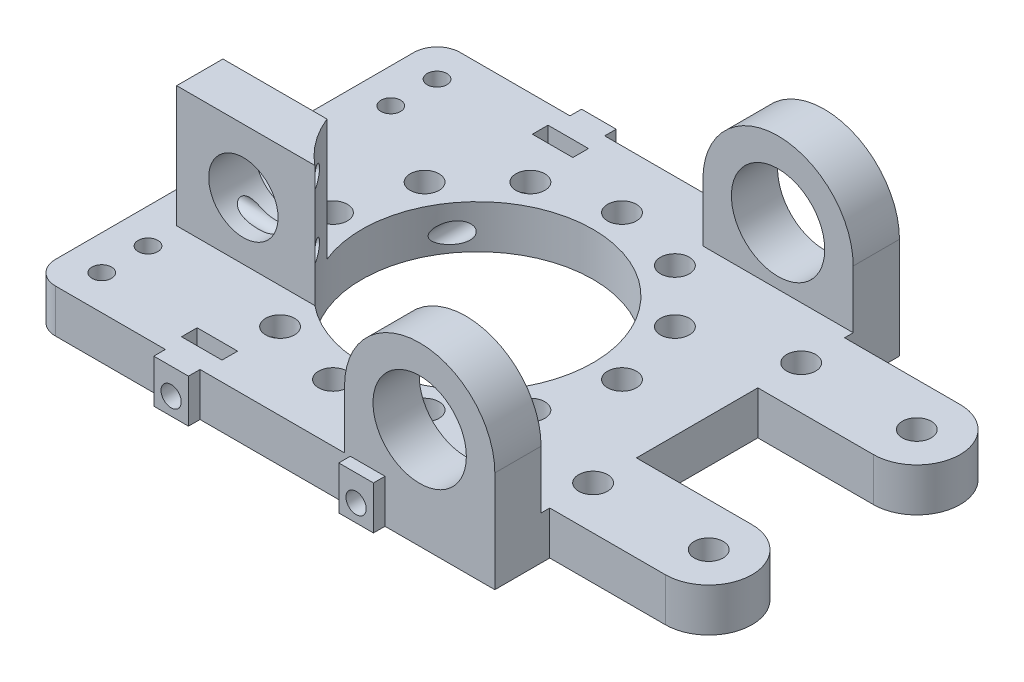
from build123d import *
from build123d.topology import SkipClean

# Parameters (mm, degrees)
BOSS_EXTRUDE1_DEPTH = 7.5
SKETCH2_W           = 6
SKETCH2_H           = 7.5
BOSS_EXTRUDE2_DEPTH = 2
SKETCH3_R           = 8.075
BOSS_EXTRUDE3_DEPTH = 8
SKETCH4_W           = 7
SKETCH4_H           = 2.7
CUT_EXTRUDE1_DEPTH  = 7.5
SKETCH5_R           = 1.7
CUT_EXTRUDE2_DEPTH  = 83.797946834
SKETCH6_R           = 20
CUT_EXTRUDE3_DEPTH  = 83.797946834
SKETCH7_R           = 2.5
CUT_EXTRUDE4_DEPTH  = 83.797946834
SKETCH8_R           = 1.75
CUT_EXTRUDE5_DEPTH  = 105.701957957
BOSS_EXTRUDE4_DEPTH = 28.5
CUT_EXTRUDE6_REACH  = 92.79
SKETCH11_R          = 6
CUT_EXTRUDE7_REACH  = 114.745
SKETCH12_R          = 1.5
SKETCH14_R          = 2.5
CUT_EXTRUDE8_DEPTH  = 83.797946834
FILLET1_R           = 4


with BuildPart() as part:
    # Sketch1 → Boss-Extrude1 (new body)
    with BuildSketch(Plane(origin=(0, 0, 0), x_dir=(1, 0, 0), z_dir=(0, 1, 0))):
        with BuildLine():
            Line((-40, 35), (40, 35))
            Line((40, 35), (40, 25.5))
            Line((40, 25.5), (60, 25.5))
            ThreePointArc((60, 25.5), (67.5, 18), (60, 10.5))
            Line((60, 10.5), (40, 10.5))
            Line((40, 10.5), (40, -10.5))
            Line((40, -10.5), (60, -10.5))
            ThreePointArc((60, -10.5), (67.5, -18), (60, -25.5))
            Line((60, -25.5), (40, -25.5))
            Line((40, -25.5), (40, -35))
            Line((40, -35), (-40, -35))
            Line((-40, -35), (-40, 35))
        make_face()
    extrude(amount=BOSS_EXTRUDE1_DEPTH)

    # Sketch2 → Boss-Extrude2 (add)
    with BuildSketch(Plane.XY.offset(35)):
        with Locations((-14, 3.75)):
            Rectangle(SKETCH2_W, SKETCH2_H)
        with Locations((18, 3.75)):
            Rectangle(SKETCH2_W, SKETCH2_H)
    boss_extrude2 = extrude(amount=BOSS_EXTRUDE2_DEPTH)

    # Sketch3 → Boss-Extrude3 (add)
    with BuildSketch(Plane.XY.offset(35)):
        with BuildLine():
            Line((40, 7.5), (14, 7.5))
            Line((14, 7.5), (14, 17.5))
            ThreePointArc((14, 17.5), (27, 30.5), (40, 17.5))
            Line((40, 17.5), (40, 7.5))
        make_face()
        with Locations((27, 17.5)):
            Circle(SKETCH3_R, mode=Mode.SUBTRACT)
    boss_extrude3 = extrude(amount=-BOSS_EXTRUDE3_DEPTH)

    # Sketch4 → Cut-Extrude1 (cut)
    with BuildSketch(Plane.XZ):
        with Locations((-14, 30.35)):
            Rectangle(SKETCH4_W, SKETCH4_H)
        with Locations((18, 30.35)):
            Rectangle(SKETCH4_W, SKETCH4_H)
    cut_extrude1 = extrude(amount=-CUT_EXTRUDE1_DEPTH, mode=Mode.SUBTRACT)

    # Sketch5 → Cut-Extrude2 (cut, through all)
    with BuildSketch(Plane.XZ):
        with Locations(Location((-34, 29, 0), (0, 0, 270))):
            Circle(SKETCH5_R)
        with Locations(Location((-34, 21, 0), (0, 0, 270))):
            Circle(SKETCH5_R)
    cut_extrude2 = extrude(amount=-CUT_EXTRUDE2_DEPTH, mode=Mode.SUBTRACT)

    # Mirror1: Boss-Extrude2, Boss-Extrude3, Cut-Extrude1, Cut-Extrude2 across plane
    add(boss_extrude2.mirror(Plane.XY))
    add(boss_extrude3.mirror(Plane.XY))
    add(cut_extrude1.mirror(Plane.XY), mode=Mode.SUBTRACT)
    add(cut_extrude2.mirror(Plane.XY), mode=Mode.SUBTRACT)

    # Sketch6 → Cut-Extrude3 (cut, through all)
    with BuildSketch(Plane.XZ):
        with Locations(Location((2, 0, 0), (0, 0, 270))):
            Circle(SKETCH6_R)
    extrude(amount=-CUT_EXTRUDE3_DEPTH, mode=Mode.SUBTRACT)

    # Sketch7 → Cut-Extrude4 (cut, through all)
    with BuildSketch(Plane.XZ):
        with Locations(Location((-23, 0, 0), (0, 0, 270))):
            Circle(SKETCH7_R)
        with Locations(Location((-10.5, 21.650635095, 0), (0, 0, 270))):
            Circle(SKETCH7_R)
        with Locations(Location((2, 25, 0), (0, 0, 270))):
            Circle(SKETCH7_R)
        with Locations(Location((14.5, 21.650635095, 0), (0, 0, 270))):
            Circle(SKETCH7_R)
        with Locations(Location((23.650635095, 12.5, 0), (0, 0, 270))):
            Circle(SKETCH7_R)
        with Locations(Location((27, 0, 0), (0, 0, 270))):
            Circle(SKETCH7_R)
        with Locations(Location((23.650635095, -12.5, 0), (0, 0, 270))):
            Circle(SKETCH7_R)
        with Locations(Location((14.5, -21.650635095, 0), (0, 0, 270))):
            Circle(SKETCH7_R)
        with Locations(Location((2, -25, 0), (0, 0, 270))):
            Circle(SKETCH7_R)
        with Locations(Location((-10.5, -21.650635095, 0), (0, 0, 270))):
            Circle(SKETCH7_R)
        with Locations(Location((-19.650635095, -12.5, 0), (0, 0, 270))):
            Circle(SKETCH7_R)
    extrude(amount=-CUT_EXTRUDE4_DEPTH, mode=Mode.SUBTRACT)

    # Sketch8 → Cut-Extrude5 (cut, through all)
    with BuildSketch(Plane(origin=(0, 0, -37), x_dir=(-1, 0, 0), z_dir=(0, 0, -1))):
        with Locations((-18, 3)):
            Circle(SKETCH8_R)
        with Locations((14, 3)):
            Circle(SKETCH8_R)
    extrude(amount=-CUT_EXTRUDE5_DEPTH, mode=Mode.SUBTRACT)

    # Sketch10 → Boss-Extrude4 (add)
    with SkipClean():  # the faces are left unmerged after this step: merging them gives an invalid solid
        with BuildSketch(Plane.XZ):
            with BuildLine():
                Line((-16.540496218, 15.5), (-10.63922466, 15.5))
                ThreePointArc((-10.63922466, 15.5), (-14.094836082, 11.8724998), (-16.540496218, 7.5))
                Line((-16.540496218, 7.5), (-34.540496218, 7.5))
                Line((-34.540496218, 7.5), (-34.540496218, 15.5))
                Line((-34.540496218, 15.5), (-16.540496218, 15.5))
            make_face()
        extrude(amount=-BOSS_EXTRUDE4_DEPTH)

    # Sketch11 → Cut-Extrude6 (cut, up to next)
    with BuildSketch(Plane.XY.offset(15.5), mode=Mode.PRIVATE) as cut_extrude6_sk1:
        with Locations((-23, 17.5)):
            Circle(SKETCH11_R)
    cut_extrude6_tool1 = extrude(cut_extrude6_sk1.sketch, amount=-CUT_EXTRUDE6_REACH, mode=Mode.PRIVATE) & part.part
    add(cut_extrude6_tool1.solids().sort_by_distance((-23, 17.5, 15.5))[0], mode=Mode.SUBTRACT)

    # Sketch12 → Cut-Extrude7 (cut, up to next)
    with BuildSketch(Plane.ZY.offset(34.540496218), mode=Mode.PRIVATE) as cut_extrude7_sk1:
        with Locations((11.5, 23.05)):
            Circle(SKETCH12_R)
    cut_extrude7_tool1 = extrude(cut_extrude7_sk1.sketch, amount=-CUT_EXTRUDE7_REACH, mode=Mode.PRIVATE) & part.part
    # Sketch12 → Cut-Extrude7 (cut, up to next)
    with BuildSketch(Plane.ZY.offset(34.540496218), mode=Mode.PRIVATE) as cut_extrude7_sk2:
        with Locations((11.5, 11.95)):
            Circle(SKETCH12_R)
    cut_extrude7_tool2 = extrude(cut_extrude7_sk2.sketch, amount=-CUT_EXTRUDE7_REACH, mode=Mode.PRIVATE) & part.part
    add(cut_extrude7_tool1.solids().sort_by_distance((-34.540496, 23.05, 11.5))[0], mode=Mode.SUBTRACT)
    add(cut_extrude7_tool2.solids().sort_by_distance((-34.540496, 11.95, 11.5))[0], mode=Mode.SUBTRACT)

    # Sketch14 → Cut-Extrude8 (cut, through all)
    with SkipClean():  # the faces are left unmerged after this step: merging them gives an invalid solid
        with BuildSketch(Plane.XZ):
            with Locations(Location((60, -18, 0), (0, 0, 270))):
                Circle(SKETCH14_R)
            with Locations(Location((40, -18, 0), (0, 0, 270))):
                Circle(SKETCH14_R)
            with Locations(Location((60, 18, 0), (0, 0, 270))):
                Circle(SKETCH14_R)
            with Locations(Location((40, 18, 0), (0, 0, 270))):
                Circle(SKETCH14_R)
        extrude(amount=-CUT_EXTRUDE8_DEPTH, mode=Mode.SUBTRACT)

    # Fillet1
    fillet1_edges = [part.edges().sort_by_distance(p)[0] for p in [
        (-40, 3.75, -35),
        (-40, 3.75, 35),
    ]]
    fillet(fillet1_edges, radius=FILLET1_R)


solid = part.part
